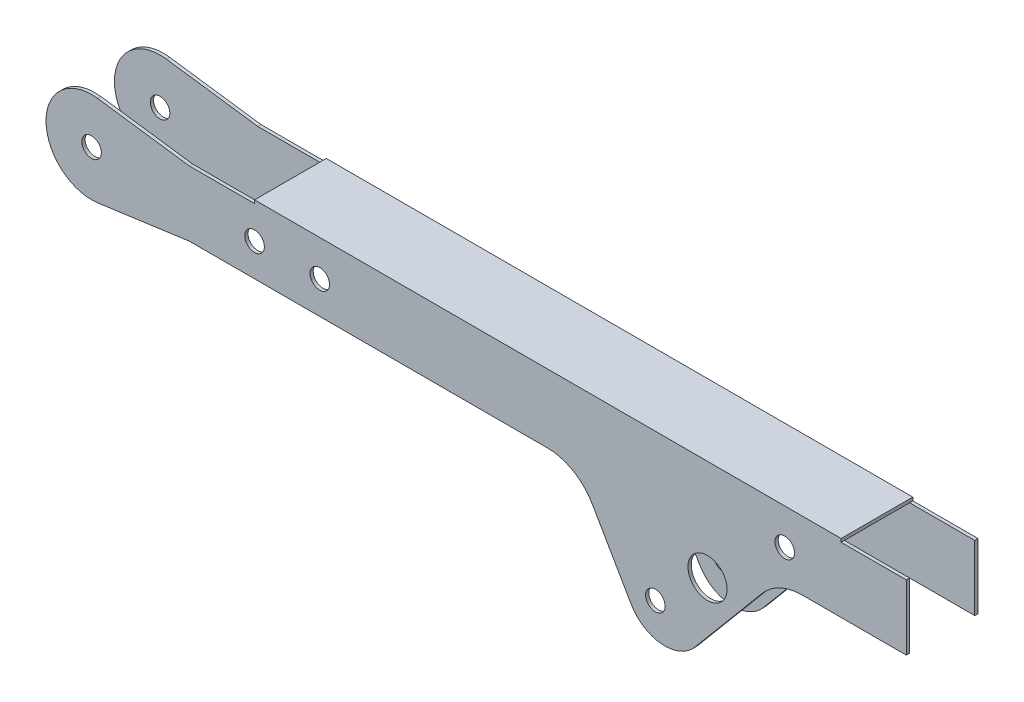
from build123d import *

# Parameters (mm, degrees)
SKETCH_1_R      = 1.5
SKETCH_1_R_2    = 3
EXTRUDE_1_DEPTH = 0.5
SKETCH_3_R      = 3
SKETCH_3_R_2    = 1.5
EXTRUDE_2_DEPTH = 0.5
SKETCH_4_W      = 90
SKETCH_4_H      = 11
EXTRUDE_3_DEPTH = 0.5
FILLET_1_R      = 8
FILLET_2_R      = 6


with BuildPart() as part:
    # 草图1 → 凸台-拉伸1 (new body)
    with BuildSketch(Plane.XY):
        with BuildLine():
            Line((-28.937588447, 12.863865809), (81.062411553, 12.863865809))
            Line((81.062411553, 12.863865809), (81.062411553, 2.863865809))
            Line((81.062411553, 2.863865809), (61.338833841, 2.863865809))
            Line((61.338833841, 2.863865809), (43.106996214, -18.863992184))
            Line((43.106996214, -18.863992184), (30.562411553, 2.863865809))
            Line((30.562411553, 2.863865809), (-28.937588447, 2.863865809))
            Line((-28.937588447, 2.863865809), (-42.98243101, 0.92933812))
            ThreePointArc((-42.98243101, 0.92933812), (-50.937588447, 7.863865809), (-42.98243101, 14.798393498))
            Line((-42.98243101, 14.798393498), (-28.937588447, 12.863865809))
        make_face()
        with Locations((-43.937588447, 7.863865809)):
            Circle(SKETCH_1_R, mode=Mode.SUBTRACT)
        with Locations((42.562411553, -9.136134191)):
            Circle(SKETCH_1_R, mode=Mode.SUBTRACT)
        with Locations((50.562411553, -2.136134191)):
            Circle(SKETCH_1_R_2, mode=Mode.SUBTRACT)
        with Locations((-18.937588447, 7.863865809)):
            Circle(SKETCH_1_R, mode=Mode.SUBTRACT)
        with Locations((-8.937588447, 7.863865809)):
            Circle(SKETCH_1_R, mode=Mode.SUBTRACT)
        with Locations((62.409410938, 7.863865809)):
            Circle(SKETCH_1_R, mode=Mode.SUBTRACT)
    extrude(amount=EXTRUDE_1_DEPTH)



with BuildPart() as body_2:
    # 草图3 → 凸台-拉伸2 (new body)
    with BuildSketch(Plane.XY.offset(-10)):
        with BuildLine():
            Line((43.106996214, -18.863992184), (61.338833841, 2.863865809))
            Line((61.338833841, 2.863865809), (81.062411553, 2.863865809))
            Line((81.062411553, 2.863865809), (81.062411553, 12.863865809))
            Line((81.062411553, 12.863865809), (-28.937588447, 12.863865809))
            Line((-28.937588447, 12.863865809), (-42.98243101, 14.798393498))
            ThreePointArc((-42.98243101, 14.798393498), (-50.937588447, 7.863865809), (-42.98243101, 0.92933812))
            Line((-42.98243101, 0.92933812), (-28.937588447, 2.863865809))
            Line((-28.937588447, 2.863865809), (30.562411553, 2.863865809))
            Line((30.562411553, 2.863865809), (43.106996214, -18.863992184))
        make_face()
        with Locations((50.562411553, -2.136134191)):
            Circle(SKETCH_3_R, mode=Mode.SUBTRACT)
        with Locations((42.562411553, -9.136134191)):
            Circle(SKETCH_3_R_2, mode=Mode.SUBTRACT)
        with Locations((-43.937588447, 7.863865809)):
            Circle(SKETCH_3_R_2, mode=Mode.SUBTRACT)
        with Locations((62.409410938, 7.863865809)):
            Circle(SKETCH_3_R_2, mode=Mode.SUBTRACT)
        with Locations((-8.937588447, 7.863865809)):
            Circle(SKETCH_3_R_2, mode=Mode.SUBTRACT)
        with Locations((-18.937588447, 7.863865809)):
            Circle(SKETCH_3_R_2, mode=Mode.SUBTRACT)
    extrude(amount=-EXTRUDE_2_DEPTH)


with BuildPart() as part_1:
    add(part.part)

    add(body_2.part)  # 凸台-拉伸3 merges body 2
    # 草图4 → 凸台-拉伸3 (add)
    with BuildSketch(Plane(origin=(0, 12.863865809, 0), x_dir=(1, 0, 0), z_dir=(0, 1, 0))):
        with Locations((26.062411553, 5)):
            Rectangle(SKETCH_4_W, SKETCH_4_H)
    extrude(amount=EXTRUDE_3_DEPTH)

    # 圆角1
    fillet_1_edges = [part_1.edges().sort_by_distance(p)[0] for p in [
        (61.338833841, 2.863865809, 0.25),
        (30.562411553, 2.863865809, 0.25),
        (30.562411553, 2.863865809, -10.25),
        (61.338833841, 2.863865809, -10.25),
    ]]
    fillet(fillet_1_edges, radius=FILLET_1_R)

    # 圆角2
    fillet_2_edges = [part_1.edges().sort_by_distance(p)[0] for p in [
        (43.106996214, -18.863992184, 0.25),
        (43.106996214, -18.863992184, -10.25),
    ]]
    fillet(fillet_2_edges, radius=FILLET_2_R)


solid = part_1.part
